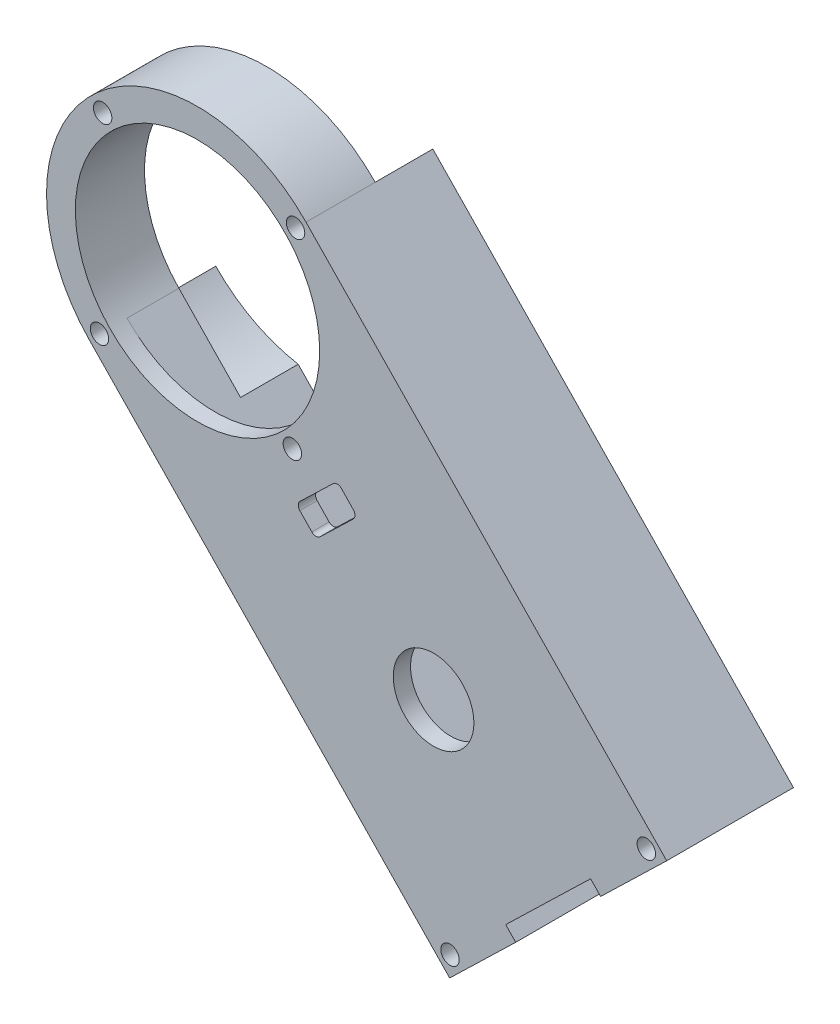
from build123d import *

# Parameters (mm, degrees)
BOSS_EXTRUDE1_DEPTH = 22
SKETCH3_R           = 26.2
CUT_EXTRUDE1_DEPTH  = 10
BOSS_EXTRUDE2_START = -3
SKETCH4_R           = 7
BOSS_EXTRUDE2_DEPTH = 3
SKETCH5_R           = 1.8
CUT_EXTRUDE2_DEPTH  = 5
SKETCH6_R           = 1.6
CUT_EXTRUDE3_DEPTH  = 119.253467405
SKETCH7_R           = 1.6
CUT_EXTRUDE4_DEPTH  = 119.253467405


with BuildPart() as part:
    # Sketch2 → Boss-Extrude1 (new body)
    with BuildSketch(Plane.XY):
        with BuildLine():
            Line((81.411807591, -46.460279646), (18.828747548, 18.218624146))
            ThreePointArc((18.828747548, 18.218624146), (-18.218624146, 18.828747548), (-18.828747548, -18.218624146))
            Line((-18.828747548, -18.218624146), (43.754312495, -82.897527937))
            Line((43.754312495, -82.897527937), (55.216851555, -71.806418963))
            Line((55.216851555, -71.806418963), (53.478433221, -70.009782747))
            Line((53.478433221, -70.009782747), (68.210850196, -55.754752404))
            Line((68.210850196, -55.754752404), (69.94926853, -57.55138862))
            Line((69.94926853, -57.55138862), (81.411807591, -46.460279646))
        make_face()
        with BuildLine():
            Line((37.468734256, -8.236041156), (74.341698489, -46.343843882))
            Line((74.341698489, -46.343843882), (43.870748258, -75.827418835))
            Line((43.870748258, -75.827418835), (6.997784026, -37.719616109))
            Line((6.997784026, -37.719616109), (-15.235475115, -14.741787477))
            ThreePointArc((-15.235475115, -14.741787477), (-14.741787477, 15.235475115), (15.235475115, 14.741787477))
            Line((15.235475115, 14.741787477), (37.468734256, -8.236041156))
        make_face(mode=Mode.SUBTRACT)
    extrude(amount=BOSS_EXTRUDE1_DEPTH)

    # Sketch3 → Cut-Extrude1 (cut)
    with BuildSketch(Plane(origin=(0, 0, 0), x_dir=(-1, 0, 0), z_dir=(0, 0, -1))):
        Circle(SKETCH3_R)
    extrude(amount=-CUT_EXTRUDE1_DEPTH, mode=Mode.SUBTRACT)

    # Sketch4 → Boss-Extrude2 (add)
    with BuildSketch(Plane.XY.offset(22).offset(BOSS_EXTRUDE2_START)):
        with BuildLine():
            Line((43.870748258, -75.827418835), (74.341698489, -46.343843882))
            Line((74.341698489, -46.343843882), (15.235475115, 14.741787477))
            ThreePointArc((15.235475115, 14.741787477), (14.741787477, -15.235475115), (-15.235475115, -14.741787477))
            Line((-15.235475115, -14.741787477), (43.870748258, -75.827418835))
        make_face()
        with Locations((40.961727216, -42.477303154)):
            Circle(SKETCH4_R, mode=Mode.SUBTRACT)
        with BuildLine():
            Line((24.96542229, -18.72640467), (27.045904207, -20.887791955))
            ThreePointArc((27.045904207, -20.887791955), (27.325259938, -21.600355505), (27.018935751, -22.301748355))
            Line((27.018935751, -22.301748355), (21.255236326, -27.849700134))
            ThreePointArc((21.255236326, -27.849700134), (20.542672775, -28.129055865), (19.841279925, -27.822731678))
            Line((19.841279925, -27.822731678), (17.760798008, -25.661344393))
            ThreePointArc((17.760798008, -25.661344393), (17.481442277, -24.948780843), (17.787766464, -24.247387993))
            Line((17.787766464, -24.247387993), (23.551465889, -18.699436214))
            ThreePointArc((23.551465889, -18.699436214), (24.264029439, -18.420080483), (24.96542229, -18.72640467))
        make_face(mode=Mode.SUBTRACT)
    extrude(amount=BOSS_EXTRUDE2_DEPTH)

    # Sketch5 → Cut-Extrude2 (cut)
    with BuildSketch(Plane(origin=(62.583060043, -64.678903792, 0), x_dir=(0.7186544865731441, 0.6953673338087509, 0), z_dir=(0.6953673338087509, -0.7186544865731441, 0))):
        with Locations((15.5, 11.5)):
            Circle(SKETCH5_R)
        with Locations((-15.5, 11.5)):
            Circle(SKETCH5_R)
    extrude(amount=-CUT_EXTRUDE2_DEPTH, mode=Mode.SUBTRACT)

    # Sketch6 → Cut-Extrude3 (cut, through all)
    with BuildSketch(Plane.XY.offset(22)):
        with Locations((77.87675304, -46.402061764)):
            Circle(SKETCH6_R)
        with Locations((43.812530376, -79.362473386)):
            Circle(SKETCH6_R)
    extrude(amount=-CUT_EXTRUDE3_DEPTH, mode=Mode.SUBTRACT)

    # Sketch7 → Cut-Extrude4 (cut, through all)
    with BuildSketch(Plane.XY.offset(22)):
        with Locations((-16.461094787, 17.012360299)):
            Circle(SKETCH7_R)
        with Locations((17.012360299, 16.461094787)):
            Circle(SKETCH7_R)
        with Locations((16.461094787, -17.012360299)):
            Circle(SKETCH7_R)
        with Locations((-17.012360299, -16.461094787)):
            Circle(SKETCH7_R)
    extrude(amount=-CUT_EXTRUDE4_DEPTH, mode=Mode.SUBTRACT)


solid = part.part
